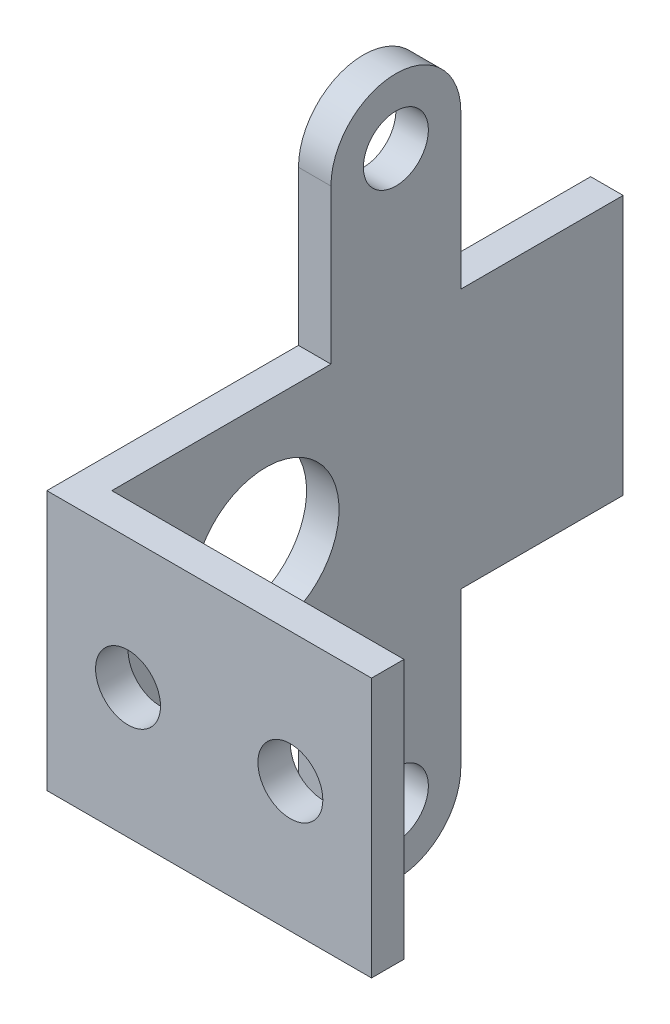
from build123d import *

# Parameters (mm, degrees)
BOSS_EXTRUDE1_DEPTH = 16
SKETCH2_R           = 2
CUT_EXTRUDE1_DEPTH  = 16
SKETCH3_R           = 2
BOSS_EXTRUDE2_DEPTH = 2
SKETCH4_R           = 4.5
CUT_EXTRUDE2_DEPTH  = 2


with BuildPart() as part:
    # Sketch1 → Boss-Extrude1 (new body)
    with BuildSketch(Plane(origin=(0, 0, 0), x_dir=(1, 0, 0), z_dir=(0, 1, 0))):
        Polygon((-4.620689655, 26), (-4.620689655, -7.5), (15.379310345, -7.5), (15.379310345, -5.5), (-2.620689655, -5.5), (-2.620689655, 26), align=None)
    extrude(amount=BOSS_EXTRUDE1_DEPTH)

    # Sketch2 → Cut-Extrude1 (cut)
    with BuildSketch(Plane.XY.offset(7.5)):
        with Locations((0.379310345, 8)):
            Circle(SKETCH2_R)
        with Locations((10.379310345, 8)):
            Circle(SKETCH2_R)
    extrude(amount=-CUT_EXTRUDE1_DEPTH, mode=Mode.SUBTRACT)

    # Sketch3 → Boss-Extrude2 (add)
    # profile 1 of 2: a face of its own
    with BuildSketch(Plane.ZY.offset(4.620689655)):
        with BuildLine():
            Line((-16, 16), (-8, 16))
            Line((-8, 16), (-8, 25.5))
            ThreePointArc((-8, 25.5), (-12, 29.5), (-16, 25.5))
            Line((-16, 25.5), (-16, 16))
        make_face()
        with Locations((-12, 25.5)):
            Circle(SKETCH3_R, mode=Mode.SUBTRACT)
    # profile 2 of 2: a face of its own
    with BuildSketch(Plane.ZY.offset(4.620689655)):
        with BuildLine():
            Line((-16, 0), (-8, 0))
            Line((-8, 0), (-8, -9.5))
            ThreePointArc((-8, -9.5), (-12, -13.5), (-16, -9.5))
            Line((-16, -9.5), (-16, 0))
        make_face()
        with Locations((-12, -9.5)):
            Circle(SKETCH3_R, mode=Mode.SUBTRACT)
    extrude(amount=-BOSS_EXTRUDE2_DEPTH)

    # Sketch4 → Cut-Extrude2 (cut)
    with BuildSketch(Plane.ZY.offset(4.620689655)):
        with Locations((-4, 8)):
            Circle(SKETCH4_R)
    extrude(amount=-CUT_EXTRUDE2_DEPTH, mode=Mode.SUBTRACT)


solid = part.part
